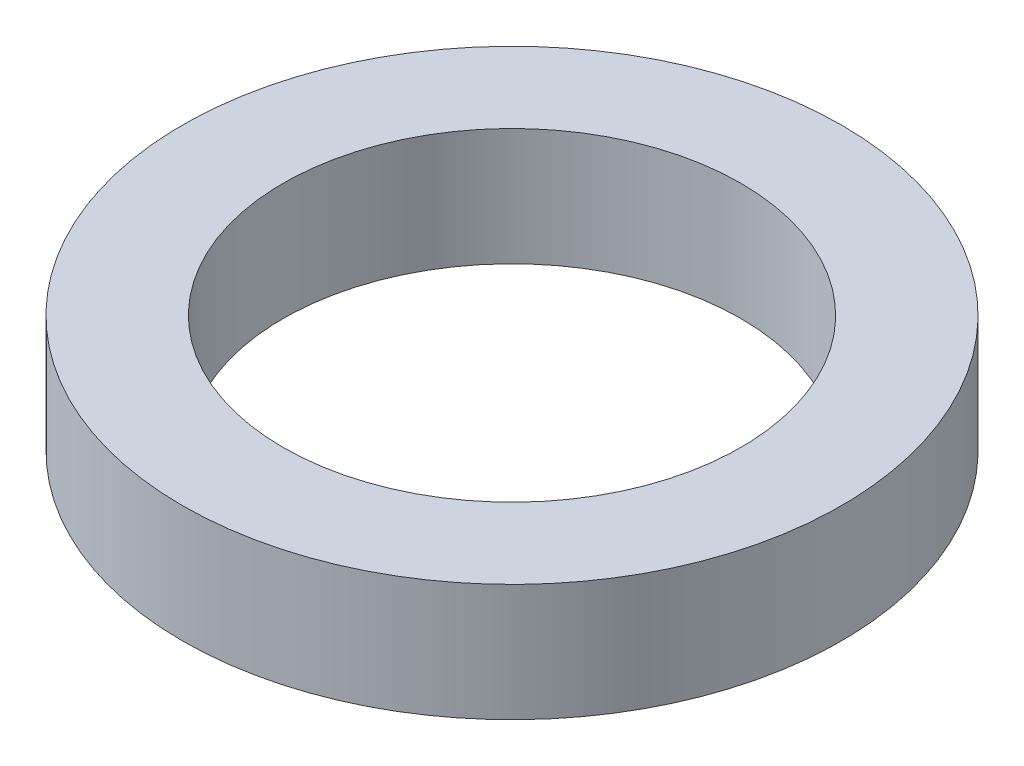
from build123d import *

# Parameters (mm, degrees)
SKETCH1_R           = 2.286
BOSS_EXTRUDE1_DEPTH = 0.8128
SKETCH5_R           = 1.5875
CUT_EXTRUDE1_DEPTH  = 4.333502038


with BuildPart() as part:
    # Sketch1 → Boss-Extrude1 (new body)
    with BuildSketch(Plane(origin=(0, 0, 0), x_dir=(1, 0, 0), z_dir=(0, 1, 0))):
        with Locations(Location((0, 0, 0), (0, 0, 270))):
            Circle(SKETCH1_R)
    extrude(amount=BOSS_EXTRUDE1_DEPTH)

    # Sketch5 → Cut-Extrude1 (cut, through all)
    with BuildSketch(Plane(origin=(0, 0.8128, 0), x_dir=(-1, 0, 0), z_dir=(0, 1, 0))):
        with Locations(Location((0, 0, 0), (0, 0, 90))):
            Circle(SKETCH5_R)
    extrude(amount=-CUT_EXTRUDE1_DEPTH, mode=Mode.SUBTRACT)


solid = part.part
